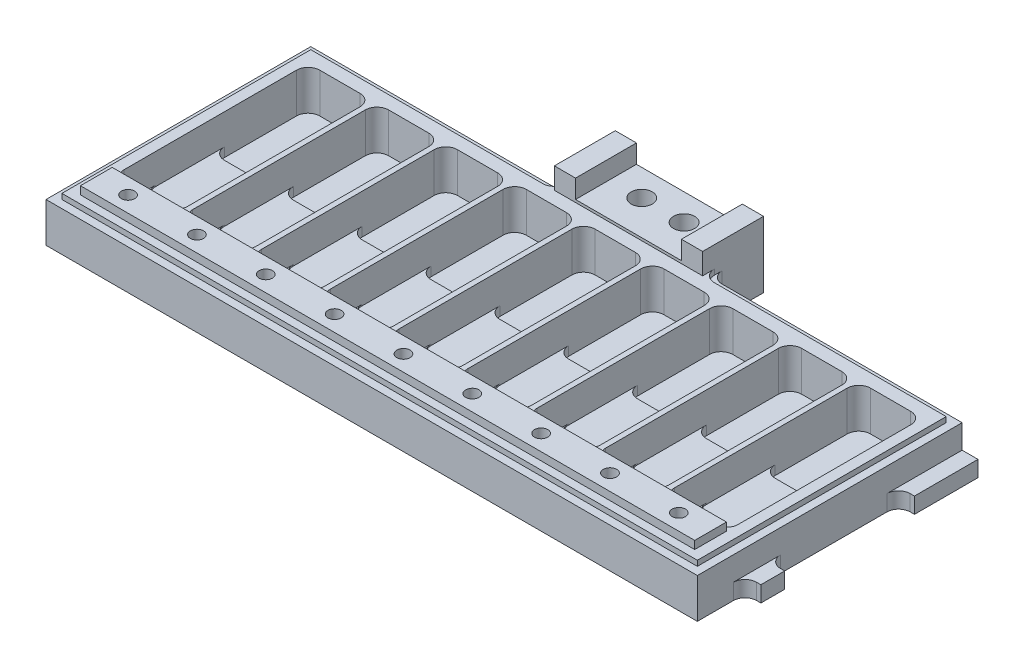
from build123d import *

# Parameters (mm, degrees)
SKETCH1_W              = 123
SKETCH1_H              = 50
BOSS_EXTRUDE1_DEPTH    = 8.5
SKETCH2_W              = 12
SKETCH2_H              = 37
CUT_EXTRUDE1_DEPTH     = 7.5
SKETCH3_W              = 12
SKETCH3_H              = 13
BOSS_EXTRUDE2_DEPTH    = 1.75
FILLET1_R              = 2.2
SKETCH12_W             = 6
SKETCH12_H             = 1.5
BOSS_EXTRUDE8_DEPTH    = 116
BOSS_EXTRUDE7_REACH    = 120.98
SKETCH10_W             = 6
SKETCH10_H             = 2
FILLET2_R              = 2.2
LPATTERN1_COUNT        = 9
LPATTERN1_PITCH        = 13
FILLET1_OF_LPATTERN1_R = 2.2
FILLET2_OF_LPATTERN1_R = 2.2
BOSS_EXTRUDE3_DEPTH    = 10
SKETCH5_R              = 2
CUT_EXTRUDE2_DEPTH     = 138.117650213
CUT_EXTRUDE3_DEPTH     = 1
SKETCH7_W              = 4
SKETCH7_H              = 1.5
BOSS_EXTRUDE4_DEPTH    = 5
SKETCH8_W              = 12
SKETCH8_H              = 3
SKETCH8_W_2            = 4.5
BOSS_EXTRUDE5_DEPTH    = 3
M3_TAPPED_HOLE1_D      = 2.5
BOSS_EXTRUDE9_START    = 0.5
SKETCH16_W             = 20
SKETCH16_H             = 11.5
SKETCH16_R             = 2
BOSS_EXTRUDE9_DEPTH    = 0.5
FILLET4_R              = 2.2
FILLET5_R              = 2.2


with BuildPart() as part:
    # Sketch1 → Boss-Extrude1 (new body)
    with BuildSketch(Plane(origin=(0, 0, 0), x_dir=(1, 0, 0), z_dir=(0, 1, 0))):
        with Locations((61.5, 25)):
            Rectangle(SKETCH1_W, SKETCH1_H)
    extrude(amount=BOSS_EXTRUDE1_DEPTH)

    # Sketch2 → Cut-Extrude1 (cut)
    with BuildSketch(Plane(origin=(0, 8.5, 0), x_dir=(1, 0, 0), z_dir=(0, 1, 0))):
        with Locations((9.5, 27.5)):
            Rectangle(SKETCH2_W, SKETCH2_H)
    cut_extrude1 = extrude(amount=-CUT_EXTRUDE1_DEPTH, mode=Mode.SUBTRACT)

    # Sketch3 → Boss-Extrude2 (add)
    with BuildSketch(Plane(origin=(0, 1, 0), x_dir=(1, 0, 0), z_dir=(0, 1, 0))):
        with Locations((9.5, 21.5)):
            Rectangle(SKETCH3_W, SKETCH3_H)
    boss_extrude2 = extrude(amount=BOSS_EXTRUDE2_DEPTH)

    # Fillet1
    fillet1_edges = [part.edges().sort_by_distance(p)[0] for p in [
        (3.5, 4.75, -46),
        (15.5, 4.75, -46),
        (3.5, 1.875, -28),
        (15.5, 1.875, -28),
    ]]
    fillet(fillet1_edges, radius=FILLET1_R)

    # Sketch12 → Boss-Extrude8 (add)
    with BuildSketch(Plane(origin=(3.5, 0, 0), x_dir=(0, 0, -1), z_dir=(1, 0, 0))):
        with Locations((6, 9.25)):
            Rectangle(SKETCH12_W, SKETCH12_H)
    extrude(amount=BOSS_EXTRUDE8_DEPTH)

    # Sketch10 → Boss-Extrude7 (add, up to next)
    with BuildSketch(Plane.ZY.offset(-15.5), mode=Mode.PRIVATE) as boss_extrude7_sk1:
        with Locations((-12, 2)):
            Rectangle(SKETCH10_W, SKETCH10_H)
    boss_extrude7_tool1 = extrude(boss_extrude7_sk1.sketch, amount=BOSS_EXTRUDE7_REACH, mode=Mode.PRIVATE) - part.part
    boss_extrude7 = boss_extrude7_tool1.solids().sort_by_distance((15.5, 2, -12))[0]
    add(boss_extrude7)

    # Fillet2
    fillet2_edges = [part.edges().sort_by_distance(p)[0] for p in [
        (3.5, 5.75, -9),
        (15.5, 5.75, -9),
        (3.5, 2.875, -15),
        (15.5, 2.875, -15),
    ]]
    fillet(fillet2_edges, radius=FILLET2_R)

    # LPattern1: Cut-Extrude1, Boss-Extrude2, Boss-Extrude7 ×9
    with Locations(*[(i * LPATTERN1_PITCH, 0, 0) for i in range(1, LPATTERN1_COUNT)]):
        add(cut_extrude1, mode=Mode.SUBTRACT)
        add(boss_extrude2)
        add(boss_extrude7)

    # Fillet1 of LPattern1
    fillet1_of_lpattern1_edges = [part.edges().sort_by_distance(p)[0] for p in [
        (16.5, 4.75, -46),
        (28.5, 4.75, -46),
        (16.5, 1.875, -28),
        (28.5, 1.875, -28),
        (29.5, 4.75, -46),
        (41.5, 4.75, -46),
        (29.5, 1.875, -28),
        (41.5, 1.875, -28),
        (42.5, 4.75, -46),
        (54.5, 4.75, -46),
        (42.5, 1.875, -28),
        (54.5, 1.875, -28),
        (55.5, 4.75, -46),
        (67.5, 4.75, -46),
        (55.5, 1.875, -28),
        (67.5, 1.875, -28),
        (68.5, 4.75, -46),
        (80.5, 4.75, -46),
        (68.5, 1.875, -28),
        (80.5, 1.875, -28),
        (81.5, 4.75, -46),
        (93.5, 4.75, -46),
        (81.5, 1.875, -28),
        (93.5, 1.875, -28),
        (94.5, 4.75, -46),
        (106.5, 4.75, -46),
        (94.5, 1.875, -28),
        (106.5, 1.875, -28),
        (107.5, 4.75, -46),
        (119.5, 4.75, -46),
        (107.5, 1.875, -28),
        (119.5, 1.875, -28),
    ]]
    fillet(fillet1_of_lpattern1_edges, radius=FILLET1_OF_LPATTERN1_R)

    # Fillet2 of LPattern1
    fillet2_of_lpattern1_edges = [part.edges().sort_by_distance(p)[0] for p in [
        (16.5, 5.75, -9),
        (28.5, 5.75, -9),
        (16.5, 2.875, -15),
        (28.5, 2.875, -15),
        (29.5, 5.75, -9),
        (41.5, 5.75, -9),
        (29.5, 2.875, -15),
        (41.5, 2.875, -15),
        (42.5, 5.75, -9),
        (54.5, 5.75, -9),
        (42.5, 2.875, -15),
        (54.5, 2.875, -15),
        (55.5, 5.75, -9),
        (67.5, 5.75, -9),
        (55.5, 2.875, -15),
        (67.5, 2.875, -15),
        (68.5, 5.75, -9),
        (80.5, 5.75, -9),
        (68.5, 2.875, -15),
        (80.5, 2.875, -15),
        (81.5, 5.75, -9),
        (93.5, 5.75, -9),
        (81.5, 2.875, -15),
        (93.5, 2.875, -15),
        (94.5, 5.75, -9),
        (106.5, 5.75, -9),
        (94.5, 2.875, -15),
        (106.5, 2.875, -15),
        (107.5, 5.75, -9),
        (119.5, 5.75, -9),
        (107.5, 2.875, -15),
        (119.5, 2.875, -15),
    ]]
    fillet(fillet2_of_lpattern1_edges, radius=FILLET2_OF_LPATTERN1_R)

    # Sketch4 → Boss-Extrude3 (add)
    with BuildSketch(Plane(origin=(0, 0, -50), x_dir=(-1, 0, 0), z_dir=(0, 0, -1))):
        Polygon((-75.5, 0), (-75.5, 12.5), (-71.5, 12.5), (-71.5, 8.5), (-51.5, 8.5), (-51.5, 12.5), (-47.5, 12.5), (-47.5, 0), align=None)
    extrude(amount=BOSS_EXTRUDE3_DEPTH)

    # Sketch5 → Cut-Extrude2 (cut, through all)
    with BuildSketch(Plane(origin=(0, 8.5, 0), x_dir=(1, 0, 0), z_dir=(0, 1, 0))):
        with Locations(Location((57.5, 55, 0), (0, 0, 180))):
            Circle(SKETCH5_R)
        with Locations(Location((65.5, 55, 0), (0, 0, 180))):
            Circle(SKETCH5_R)
    extrude(amount=-CUT_EXTRUDE2_DEPTH, mode=Mode.SUBTRACT)

    # Sketch6 → Cut-Extrude3 (cut)
    with BuildSketch(Plane(origin=(0, 8.5, 0), x_dir=(1, 0, 0), z_dir=(0, 1, 0))):
        Polygon((0, 50), (47.5, 50), (47.5, 48.5), (1.5, 48.5), (1.5, 1.5), (121.5, 1.5), (121.5, 48.5), (75.5, 48.5), (75.5, 50), (123, 50), (123, 0), (0, 0), align=None)
    extrude(amount=-CUT_EXTRUDE3_DEPTH, mode=Mode.SUBTRACT)

    # Sketch7 → Boss-Extrude4 (add)
    with BuildSketch(Plane(origin=(0, 7.5, 0), x_dir=(1, 0, 0), z_dir=(0, 1, 0))):
        with Locations((49.5, 49.25)):
            Rectangle(SKETCH7_W, SKETCH7_H)
        with Locations((73.5, 49.25)):
            Rectangle(SKETCH7_W, SKETCH7_H)
    extrude(amount=BOSS_EXTRUDE4_DEPTH)

    # Sketch8 → Boss-Extrude5 (add)
    with BuildSketch(Plane.ZY):
        with Locations((-44, 1.5)):
            Rectangle(SKETCH8_W, SKETCH8_H)
        with Locations((-11.25, 1.5)):
            Rectangle(SKETCH8_W_2, SKETCH8_H)
    boss_extrude5 = extrude(amount=BOSS_EXTRUDE5_DEPTH)

    # Mirror1: Boss-Extrude5 across plane
    add(boss_extrude5.mirror(Plane.ZY.offset(-61.5)))

    # M3 Tapped Hole1 (through all)
    with Locations(Plane(origin=(0, 10, 0), x_dir=(1, 0, 0), z_dir=(0, 1, 0))):
        with Locations((9.5, 6), (22.5, 6), (35.5, 6), (48.5, 6), (61.5, 6), (74.5, 6), (87.5, 6), (100.5, 6), (113.5, 6)):
            Hole(M3_TAPPED_HOLE1_D / 2)

    # Sketch16 → Boss-Extrude9 (add)
    with BuildSketch(Plane(origin=(0, 8.5, 0), x_dir=(1, 0, 0), z_dir=(0, 1, 0)).offset(BOSS_EXTRUDE9_START)):
        with Locations((61.5, 54.25)):
            Rectangle(SKETCH16_W, SKETCH16_H)
        with Locations(Location((65.5, 55, 0), (0, 0, 180))):
            Circle(SKETCH16_R, mode=Mode.SUBTRACT)
        with Locations(Location((57.5, 55, 0), (0, 0, 180))):
            Circle(SKETCH16_R, mode=Mode.SUBTRACT)
    extrude(amount=-BOSS_EXTRUDE9_DEPTH)

    # Fillet4
    fillet4_edges = [part.edges().sort_by_distance(p)[0] for p in [
        (47.5, 3.75, -50),
        (75.5, 3.75, -50),
        (0, 1.5, -38),
        (0, 1.5, -9),
        (0, 1.5, -13.5),
        (123, 1.5, -38),
        (123, 1.5, -9),
        (123, 1.5, -13.5),
    ]]
    fillet(fillet4_edges, radius=FILLET4_R)

    # Fillet5
    fillet5_edges = [part.edges().sort_by_distance(p)[0] for p in [
        (47.5, 8, -48.5),
        (75.5, 8, -48.5),
    ]]
    fillet(fillet5_edges, radius=FILLET5_R)


solid = part.part
